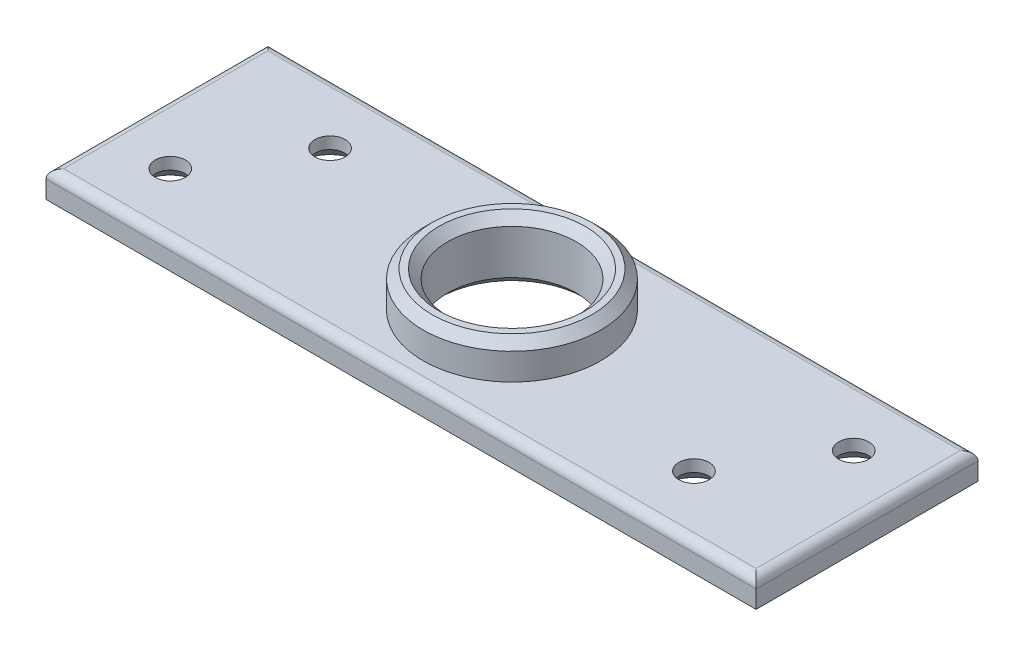
from build123d import *

# Parameters (mm, degrees)
ESBO_O1_W                           = 80
ESBO_O1_H                           = 25
ESBO_O1_R                           = 10
RESSALTO_EXTRUS_O1_DEPTH            = 1.5
ESBO_O2_R                           = 10
ESBO_O2_R_2                         = 7.25
RESSALTO_EXTRUS_O2_DEPTH            = 7
CHANFRO1_SIZE                       = 1
FILETE1_R                           = 1
ESCAREADO_PARA_SFHCS_M31_AT_2_COUNT = 2
ESCAREADO_PARA_SFHCS_M31_AT_2_PITCH = 13.03840481
ESCAREADO_PARA_SFHCS_M31_AT_3_COUNT = 2
ESCAREADO_PARA_SFHCS_M31_AT_3_PITCH = 59
ESCAREADO_PARA_SFHCS_M31_AT_4_COUNT = 2
ESCAREADO_PARA_SFHCS_M31_AT_4_PITCH = 66.910387833


with BuildPart() as part:
    # Esboço1 → Ressalto-extrusão1 (new, symmetric)
    with BuildSketch(Plane(origin=(0, 0, 0), x_dir=(1, 0, 0), z_dir=(0, 1, 0))):
        Rectangle(ESBO_O1_W, ESBO_O1_H)
        with Locations(Location((0, 0, 0), (0, 0, 270))):
            Circle(ESBO_O1_R, mode=Mode.SUBTRACT)
    extrude(amount=RESSALTO_EXTRUS_O1_DEPTH, both=True)

    # Filete1
    filete1_edges = [part.edges().sort_by_distance(p)[0] for p in [
        (-40, 1.5, 0),
        (0, 1.5, 12.5),
        (40, 1.5, 0),
        (0, 1.5, -12.5),
    ]]
    fillet(filete1_edges, radius=FILETE1_R)

    # Esboço5 → Escareado para SFHCS M31 (revolve, cut)
    with BuildSketch(Plane(origin=(33, -1.5, -5.5), x_dir=(0, 0, -1), z_dir=(1, 0, 0))):
        Polygon((0, 0), (0, 7), (1.7, 7), (1.7, 1.66), (3.36, 0), align=None)
    escareado_para_sfhcs_m31 = revolve(axis=Axis((33, -7.85, -5.5), (0, 1, 0)), mode=Mode.SUBTRACT)

    # Escareado para SFHCS M31 at 2: Escareado para SFHCS M31 ×2
    with Locations(*[Vector(-0.53687549219316, 0, 0.843661487732107) * (i * ESCAREADO_PARA_SFHCS_M31_AT_2_PITCH) for i in range(1, ESCAREADO_PARA_SFHCS_M31_AT_2_COUNT)]):
        add(escareado_para_sfhcs_m31, mode=Mode.SUBTRACT)

    # Escareado para SFHCS M31 at 3: Escareado para SFHCS M31 ×2
    with Locations(*[(-i * ESCAREADO_PARA_SFHCS_M31_AT_3_PITCH, 0, 0) for i in range(1, ESCAREADO_PARA_SFHCS_M31_AT_3_COUNT)]):
        add(escareado_para_sfhcs_m31, mode=Mode.SUBTRACT)

    # Escareado para SFHCS M31 at 4: Escareado para SFHCS M31 ×2
    with Locations(*[Vector(-0.9863939238321439, 0, 0.16439898730535696) * (i * ESCAREADO_PARA_SFHCS_M31_AT_4_PITCH) for i in range(1, ESCAREADO_PARA_SFHCS_M31_AT_4_COUNT)]):
        add(escareado_para_sfhcs_m31, mode=Mode.SUBTRACT)


with BuildPart() as body_2:
    # Esboço2 → Ressalto-extrusão2 (new body)
    with BuildSketch(Plane.XZ.offset(1.5)):
        with Locations(Location((0, 0, 0), (0, 0, 270))):
            Circle(ESBO_O2_R)
        with Locations(Location((0, 0, 0), (0, 0, 270))):
            Circle(ESBO_O2_R_2, mode=Mode.SUBTRACT)
    extrude(amount=-RESSALTO_EXTRUS_O2_DEPTH)

    # Chanfro1
    chanfro1_edges = [body_2.edges().sort_by_distance(p)[0] for p in [
        (0, -1.5, 10),
        (0, -1.5, 7.25),
        (0, 5.5, 10),
        (0, 5.5, 7.25),
    ]]
    chamfer(chanfro1_edges, length=CHANFRO1_SIZE)


solid = Compound([part.part, body_2.part])
